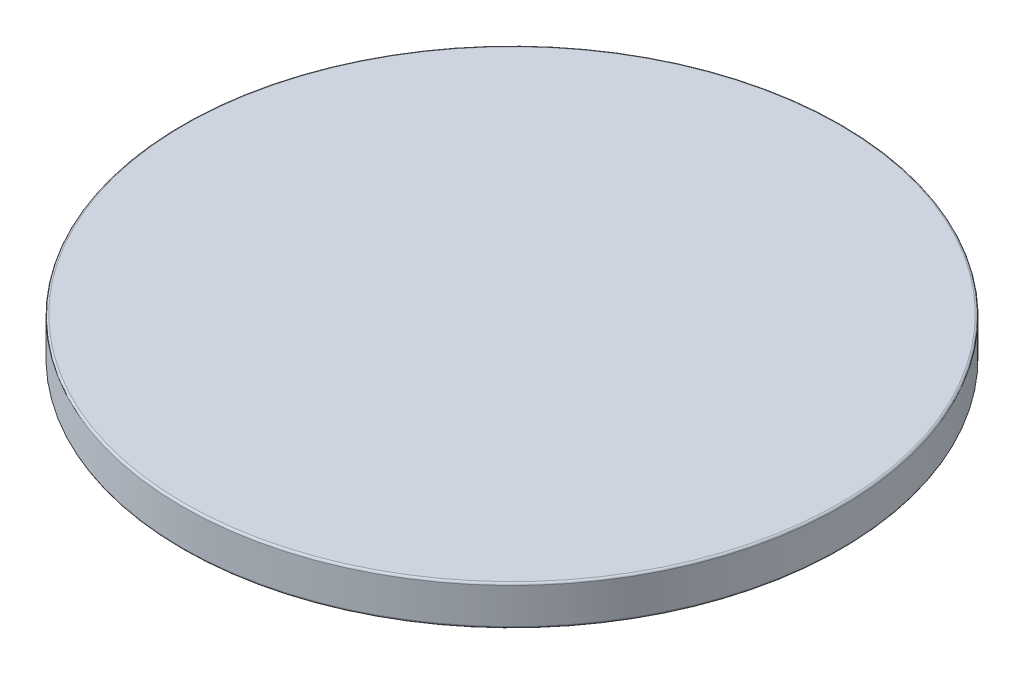
from build123d import *


with BuildPart() as part:
    # Sketch1 → Revolve1 (revolve)
    with BuildSketch(Plane(origin=(0, 0, 0), x_dir=(0, 0, -1), z_dir=(1, 0, 0))):
        with BuildLine():
            Line((0, 0.75), (-12.425000012, 0.75))
            ThreePointArc((-12.425000012, 0.75), (-12.478047732, 0.728018293), (-12.5, 0.674958384))
            Line((-12.5, 0.674958384), (-12.5, -0.674958384))
            ThreePointArc((-12.5, -0.674958384), (-12.478047732, -0.728018293), (-12.425000012, -0.75))
            Line((-12.425000012, -0.75), (0, -0.75))
            Line((0, -0.75), (0, 0.75))
        make_face()
    revolve(axis=Axis((0, 14.413134572, 0), (0, -1, 0)))


solid = part.part
